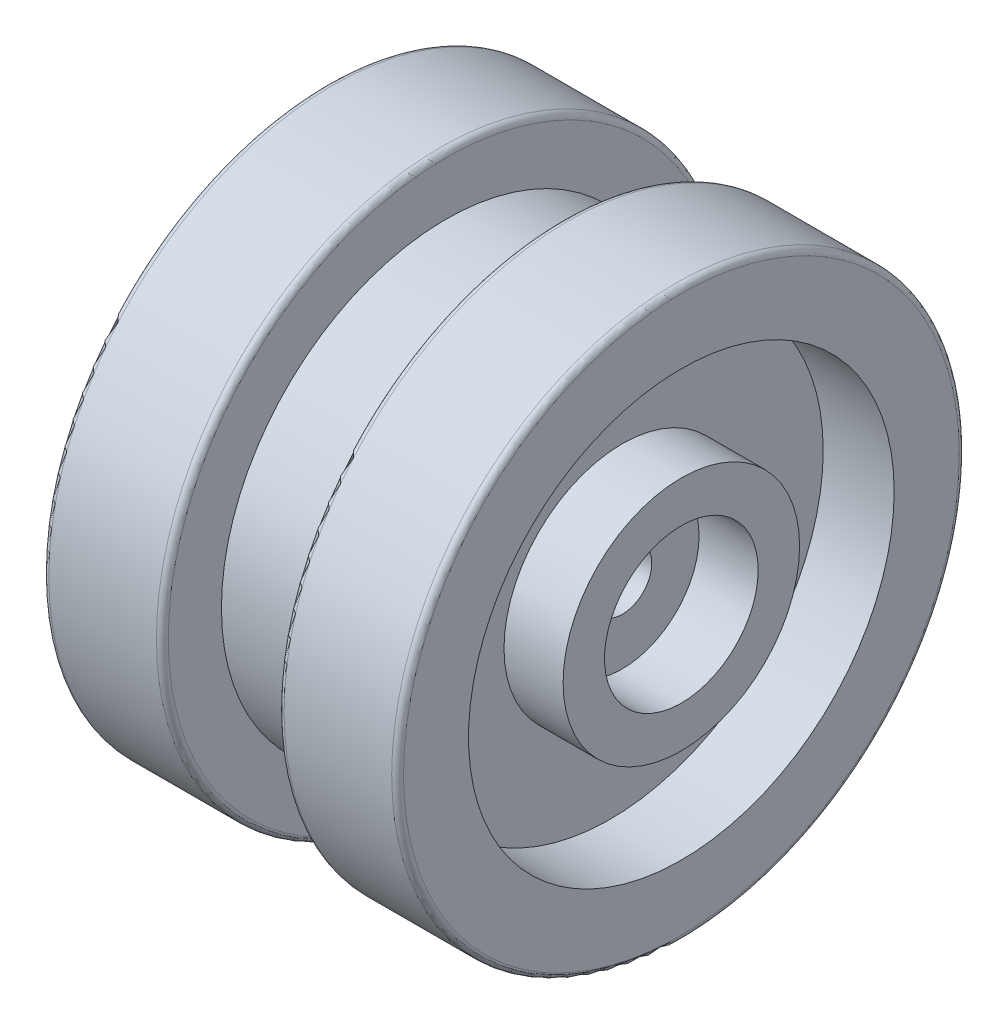
from build123d import *

# Parameters (mm, degrees)
SKETCH3_R           = 2
CUT_EXTRUDE1_DEPTH  = 58.27924924
FILLET2_R           = 0.5
SKETCH4_R           = 18
SKETCH4_R_2         = 6
CUT_EXTRUDE2_DEPTH  = 6
CUT_EXTRUDE3_START  = -6
SKETCH5_R           = 18
CUT_EXTRUDE3_DEPTH  = 6
SKETCH6_R           = 10
BOSS_EXTRUDE1_DEPTH = 6
SKETCH8_R           = 8
BOSS_EXTRUDE2_DEPTH = 10
SKETCH10_R          = 6.5
CUT_EXTRUDE5_DEPTH  = 5
SKETCH11_R          = 10
BOSS_EXTRUDE3_DEPTH = 5
CUT_EXTRUDE6_START  = -5
SKETCH12_R          = 6.5
CUT_EXTRUDE6_DEPTH  = 5
SKETCH7_R           = 2.5
CUT_EXTRUDE8_DEPTH  = 58.279249356


with BuildPart() as part:
    # Sketch2 → Revolve1 (revolve)
    with BuildSketch(Plane.XY, mode=Mode.PRIVATE) as revolve1_sk:
        Polygon((-2.565200875, 0.515739462), (7.234799125, 0.515739462), (7.234799125, 5.515739462), (17.334799125, 5.515739462), (17.334799125, -18.484260538), (-12.665200875, -18.484260538), (-12.665200875, 5.515739462), (-2.565200875, 5.515739462), align=None)
    revolve(revolve1_sk.sketch.rotate(Axis((-12.665200875, -18.484260538, 0), (1, 0, 0)), 90), axis=Axis((-12.665200875, -18.484260538, 0), (1, 0, 0)))

    # Sketch3 → Cut-Extrude1 (cut, through all)
    with BuildSketch(Plane(origin=(17.334799125, 0, 0), x_dir=(0, 0, -1), z_dir=(1, 0, 0))):
        with Locations((0, -18.484260538)):
            Circle(SKETCH3_R)
    extrude(amount=-CUT_EXTRUDE1_DEPTH, mode=Mode.SUBTRACT)

    # Fillet2
    fillet2_edges = [part.edges().sort_by_distance(p)[0] for p in [
        (-2.565200875, -18.484260538, -24),
        (7.234799125, -18.484260538, -24),
        (17.334799125, -18.484260538, -24),
        (-12.665200875, -18.484260538, -24),
    ]]
    fillet(fillet2_edges, radius=FILLET2_R)

    # Sketch4 → Cut-Extrude2 (cut)
    with BuildSketch(Plane(origin=(17.334799125, 0, 0), x_dir=(0, 0, -1), z_dir=(1, 0, 0))):
        with Locations((0, -18.484260538)):
            Circle(SKETCH4_R)
        with Locations((0, -18.484260538)):
            Circle(SKETCH4_R_2, mode=Mode.SUBTRACT)
    extrude(amount=-CUT_EXTRUDE2_DEPTH, mode=Mode.SUBTRACT)

    # Sketch5 → Cut-Extrude3 (cut)
    with BuildSketch(Plane.ZY.offset(12.665200875).offset(CUT_EXTRUDE3_START)):
        with Locations(Location((0, -18.484260538, 0), (0, 0, 180))):
            Circle(SKETCH5_R)
    extrude(amount=CUT_EXTRUDE3_DEPTH, mode=Mode.SUBTRACT)

    # Sketch6 → Boss-Extrude1 (add, through all)
    with BuildSketch(Plane.ZY.offset(6.665200875)):
        with Locations((0, -18.484260538)):
            Circle(SKETCH6_R)
    extrude(amount=BOSS_EXTRUDE1_DEPTH)

    # Sketch8 → Boss-Extrude2 (add)
    with BuildSketch(Plane(origin=(17.334799125, 0, 0), x_dir=(0, 0, -1), z_dir=(1, 0, 0))):
        with Locations((0, -18.484260538)):
            Circle(SKETCH8_R)
    extrude(amount=-BOSS_EXTRUDE2_DEPTH)

    # Sketch10 → Cut-Extrude5 (cut)
    with BuildSketch(Plane.ZY.offset(12.665200875)):
        with Locations((0, -18.484260538)):
            Circle(SKETCH10_R)
    extrude(amount=-CUT_EXTRUDE5_DEPTH, mode=Mode.SUBTRACT)

    # Sketch11 → Boss-Extrude3 (add)
    with BuildSketch(Plane(origin=(17.334799125, 0, 0), x_dir=(0, 0, -1), z_dir=(1, 0, 0))):
        with Locations(Location((0, -18.484260538, 0), (0, 0, 180))):
            Circle(SKETCH11_R)
    extrude(amount=-BOSS_EXTRUDE3_DEPTH)

    # Sketch12 → Cut-Extrude6 (cut)
    with BuildSketch(Plane(origin=(17.334799125, 0, 0), x_dir=(0, 0, -1), z_dir=(1, 0, 0)).offset(CUT_EXTRUDE6_START)):
        with Locations(Location((0, -18.484260538, 0), (0, 0, 180))):
            Circle(SKETCH12_R)
    extrude(amount=CUT_EXTRUDE6_DEPTH, mode=Mode.SUBTRACT)

    # Sketch7 → Cut-Extrude8 (cut, through all)
    with BuildSketch(Plane.ZY.offset(12.665200875)):
        with Locations((0, -18.484260538)):
            Circle(SKETCH7_R)
    extrude(amount=-CUT_EXTRUDE8_DEPTH, mode=Mode.SUBTRACT)


solid = part.part
